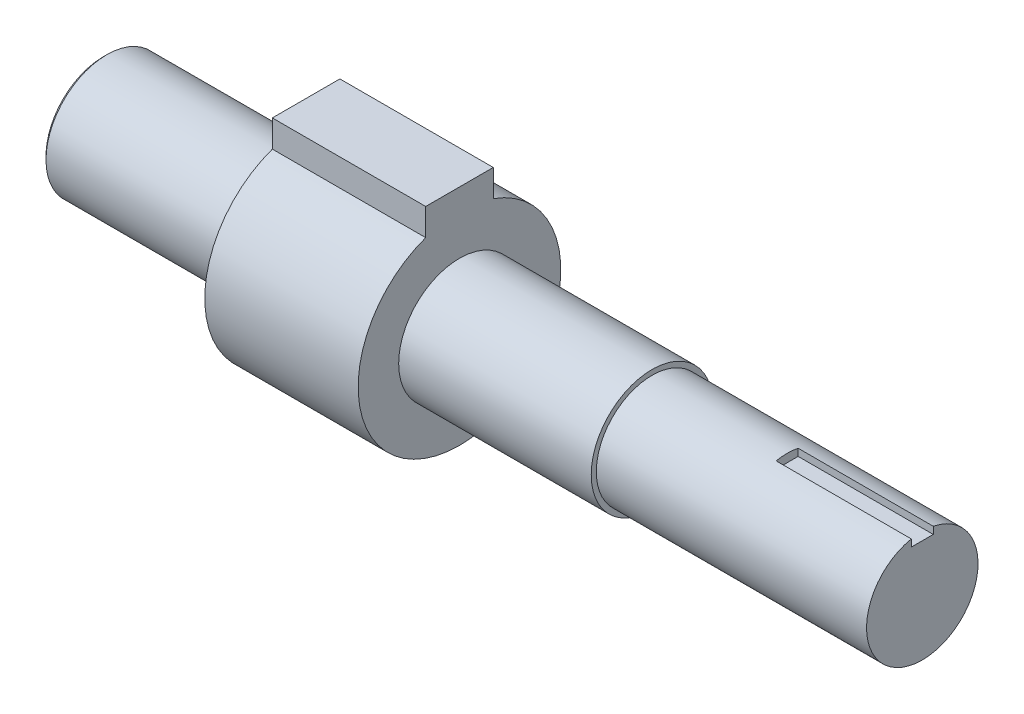
from build123d import *

# Parameters (mm, degrees)
SKETCH1_W           = 30
SKETCH1_H           = 9
BOSS_EXTRUDE1_DEPTH = 22.7
SKETCH3_R           = 9
BOSS_EXTRUDE2_DEPTH = 28.5
SKETCH4_R           = 8.25
BOSS_EXTRUDE3_DEPTH = 40
SKETCH5_W           = 3.25
SKETCH5_H           = 1.5
CUT_EXTRUDE1_DEPTH  = 20
CHAMFER1_SIZE       = 0.5


with BuildPart() as part:
    # Sketch1 → Revolve1 (revolve)
    with BuildSketch(Plane.XY, mode=Mode.PRIVATE) as revolve1_sk:
        with Locations((15, 4.5)):
            Rectangle(SKETCH1_W, SKETCH1_H)
    revolve(revolve1_sk.sketch.rotate(Axis((0, 0, 0), (1, 0, 0)), 90), axis=Axis((0, 0, 0), (1, 0, 0)))

    # Sketch2 → Boss-Extrude1 (add)
    with BuildSketch(Plane(origin=(30, 0, 0), x_dir=(0, 0, -1), z_dir=(1, 0, 0))):
        with BuildLine():
            Line((-5, 18.142135624), (5, 18.142135624))
            Line((5, 18.142135624), (5, 14.142135624))
            ThreePointArc((5, 14.142135624), (0, -15), (-5, 14.142135624))
            Line((-5, 14.142135624), (-5, 18.142135624))
        make_face()
    extrude(amount=BOSS_EXTRUDE1_DEPTH)

    # Sketch3 → Boss-Extrude2 (add)
    with BuildSketch(Plane(origin=(52.7, 0, 0), x_dir=(0, 0, -1), z_dir=(1, 0, 0))):
        with Locations(Location((0, 0, 0), (0, 0, 180))):
            Circle(SKETCH3_R)
    extrude(amount=BOSS_EXTRUDE2_DEPTH)

    # Sketch4 → Boss-Extrude3 (add)
    with BuildSketch(Plane(origin=(81.2, 0, 0), x_dir=(0, 0, -1), z_dir=(1, 0, 0))):
        Circle(SKETCH4_R)
    extrude(amount=BOSS_EXTRUDE3_DEPTH)

    # Sketch5 → Cut-Extrude1 (cut)
    with BuildSketch(Plane(origin=(121.2, 0, 0), x_dir=(0, 0, -1), z_dir=(1, 0, 0))):
        with Locations((0, 7.79)):
            Rectangle(SKETCH5_W, SKETCH5_H)
    extrude(amount=-CUT_EXTRUDE1_DEPTH, mode=Mode.SUBTRACT)

    # Chamfer1
    chamfer1_edges = [part.edges().sort_by_distance(p)[0] for p in [
        (0, 0, -9),
    ]]
    chamfer(chamfer1_edges, length=CHAMFER1_SIZE)


solid = part.part
